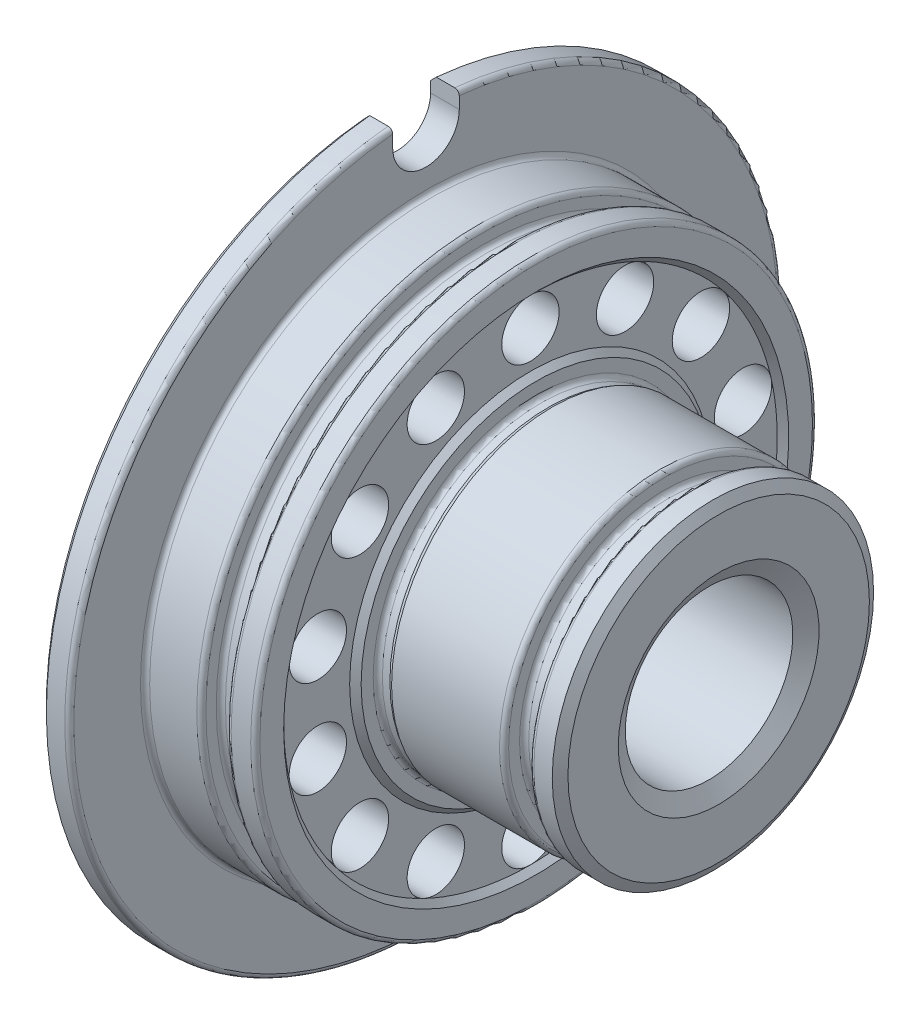
from build123d import *

# Parameters (mm, degrees)
EXTRUDE1_REACH    = 54.109
SKETCH2_R         = 2.5
EXTRUDE2_REACH    = 54.109
CIRPATTERN1_COUNT = 7


with BuildPart() as part:
    # Sketch1 → Revolve1 (revolve)
    with BuildSketch(Plane.XY, mode=Mode.PRIVATE) as revolve1_sk:
        with BuildLine():
            Line((0.4, 7.3), (27.16284211, 7.3))
            Line((27.16284211, 7.3), (28, 8.75))
            Line((28, 8.75), (28, 13.133974596))
            Line((28, 13.133974596), (27.5, 14))
            Line((27.5, 14), (25.9, 14))
            ThreePointArc((25.9, 14), (25.617157288, 13.882842712), (25.5, 13.6))
            Line((25.5, 13.6), (25.5, 12.65))
            ThreePointArc((25.5, 12.65), (25.382842712, 12.367157288), (25.1, 12.25))
            Line((25.1, 12.25), (23.7, 12.25))
            ThreePointArc((23.7, 12.25), (23.417157288, 12.367157288), (23.3, 12.65))
            Line((23.3, 12.65), (23.3, 13.6))
            ThreePointArc((23.3, 13.6), (23.182842712, 13.882842712), (22.9, 14))
            Line((22.9, 14), (13.5, 14))
            Line((13.5, 14), (13.153589838, 13.8))
            Line((13.153589838, 13.8), (12.5, 13.8))
            ThreePointArc((12.5, 13.8), (12.217157288, 13.917157288), (12.1, 14.2))
            Line((12.1, 14.2), (12.1, 15.25))
            Line((12.1, 15.25), (11.6, 15.75))
            Line((11.6, 15.75), (11.6, 21.5))
            Line((11.6, 21.5), (12.1, 22))
            Line((12.1, 22), (12.1, 24.075))
            ThreePointArc((12.1, 24.075), (11.982842712, 24.357842712), (11.7, 24.475))
            Line((11.7, 24.475), (10, 24.475))
            ThreePointArc((10, 24.475), (9.717157288, 24.357842712), (9.6, 24.075))
            Line((9.6, 24.075), (9.6, 23.175))
            ThreePointArc((9.6, 23.175), (9.482842712, 22.892157288), (9.2, 22.775))
            Line((9.2, 22.775), (7.8, 22.775))
            ThreePointArc((7.8, 22.775), (7.517157288, 22.892157288), (7.4, 23.175))
            Line((7.4, 23.175), (7.4, 24.075))
            ThreePointArc((7.4, 24.075), (7.282842712, 24.357842712), (7, 24.475))
            Line((7, 24.475), (2.9, 24.475))
            ThreePointArc((2.9, 24.475), (2.617157288, 24.592157288), (2.5, 24.875))
            Line((2.5, 24.875), (2.5, 30.675))
            ThreePointArc((2.5, 30.675), (2.382842712, 30.957842712), (2.1, 31.075))
            Line((2.1, 31.075), (0.5, 31.075))
            Line((0.5, 31.075), (0, 30.575))
            Line((0, 30.575), (0, 13.9))
            Line((0, 13.9), (0.4, 13.5))
            Line((0.4, 13.5), (0.4, 7.3))
        make_face()
    revolve(revolve1_sk.sketch.rotate(Axis((0, 0, 0), (1, 0, 0)), 90), axis=Axis((0, 0, 0), (1, 0, 0)))

    # Sketch2 → Extrude1 (cut, up to next)
    with BuildSketch(Plane.ZY, mode=Mode.PRIVATE) as extrude1_sk1:
        with Locations((0, 19)):
            Circle(SKETCH2_R)
    extrude1_tool1 = extrude(extrude1_sk1.sketch, amount=-EXTRUDE1_REACH, mode=Mode.PRIVATE) & part.part
    # Sketch2 → Extrude1 (cut, up to next)
    with BuildSketch(Plane.ZY, mode=Mode.PRIVATE) as extrude1_sk2:
        with Locations(Location((0, -19, 0), (0, 0, 269.999454858))):
            Circle(SKETCH2_R)
    extrude1_tool2 = extrude(extrude1_sk2.sketch, amount=-EXTRUDE1_REACH, mode=Mode.PRIVATE) & part.part
    extrude1_1 = extrude1_tool1.solids().sort_by_distance((0, 19, 0))[0]
    add(extrude1_1, mode=Mode.SUBTRACT)
    extrude1_2 = extrude1_tool2.solids().sort_by_distance((0, -19, 0))[0]
    add(extrude1_2, mode=Mode.SUBTRACT)
    extrude1 = extrude1_1 + extrude1_2  # Extrude1 as one shape, for the pattern or mirror that repeats it

    # Sketch3 → Extrude2 (cut, up to next)
    with BuildSketch(Plane.ZY, mode=Mode.PRIVATE) as extrude2_sk1:
        with BuildLine():
            Line((2.9, 29.5), (2.9, 30.939386306))
            ThreePointArc((2.9, 30.939386306), (0, 31.075), (-2.9, 30.939386306))
            Line((-2.9, 30.939386306), (-2.9, 29.5))
            ThreePointArc((-2.9, 29.5), (0, 26.6), (2.9, 29.5))
        make_face()
    extrude2_tool1 = extrude(extrude2_sk1.sketch, amount=-EXTRUDE2_REACH, mode=Mode.PRIVATE) & part.part
    add(extrude2_tool1.solids().sort_by_distance((0, 29.071287, 0))[0], mode=Mode.SUBTRACT)

    # CirPattern1: Extrude1 ×7 about axis
    cirpattern1_axis = Axis((0, 0, 0), (1, 0, 0))
    for i in range(1, CIRPATTERN1_COUNT):
        add(extrude1.rotate(cirpattern1_axis, i * 360 / CIRPATTERN1_COUNT), mode=Mode.SUBTRACT)


solid = part.part
